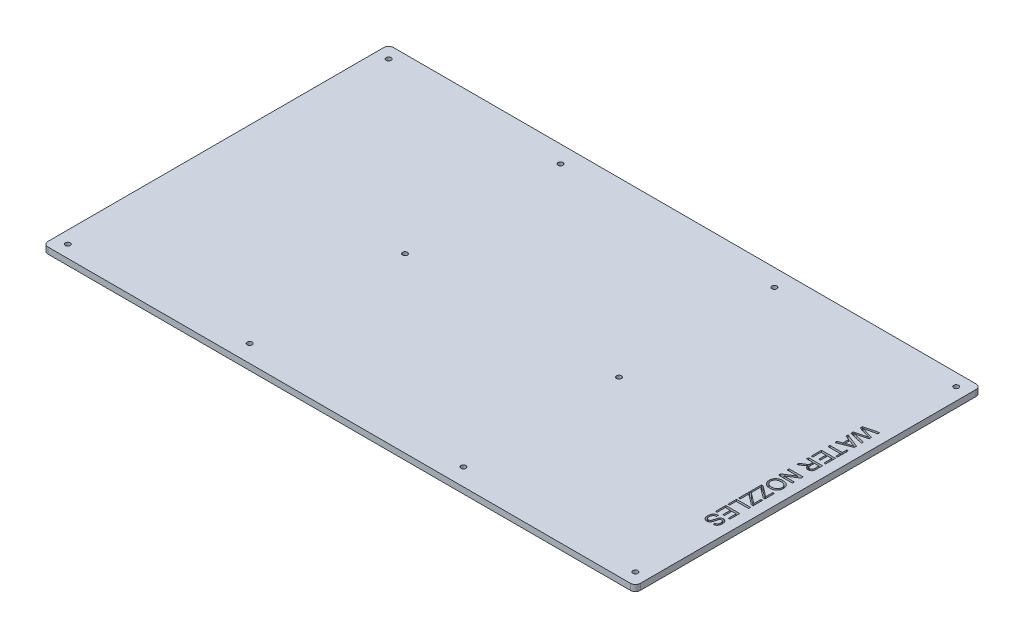
from build123d import *

# Parameters (mm, degrees)
SKETCH1_W           = 304.8
SKETCH1_H           = 177.8
SKETCH1_R           = 1.27
BOSS_EXTRUDE1_DEPTH = 3.175
CUT_EXTRUDE1_DEPTH  = 2.54
FILLET1_R           = 2.54


with BuildPart() as part:
    # Sketch1 → Boss-Extrude1 (new body)
    with BuildSketch(Plane(origin=(0, 0, 0), x_dir=(1, 0, 0), z_dir=(0, 1, 0))):
        Rectangle(SKETCH1_W, SKETCH1_H)
        with Locations(Location((-55.0291, 80.01, 0), (0, 0, 270))):
            Circle(SKETCH1_R, mode=Mode.SUBTRACT)
        with Locations(Location((-55.033333333, 0, 0), (0, 0, 270))):
            Circle(SKETCH1_R, mode=Mode.SUBTRACT)
        with Locations(Location((-55.0291, -80.01, 0), (0, 0, 270))):
            Circle(SKETCH1_R, mode=Mode.SUBTRACT)
        with Locations(Location((55.0291, -80.01, 0), (0, 0, 270))):
            Circle(SKETCH1_R, mode=Mode.SUBTRACT)
        with Locations(Location((55.033333333, 0, 0), (0, 0, 270))):
            Circle(SKETCH1_R, mode=Mode.SUBTRACT)
        with Locations(Location((55.0291, 80.01, 0), (0, 0, 270))):
            Circle(SKETCH1_R, mode=Mode.SUBTRACT)
        with Locations(Location((-146.05, 82.55, 0), (0, 0, 270))):
            Circle(SKETCH1_R, mode=Mode.SUBTRACT)
        with Locations(Location((-146.05, -82.55, 0), (0, 0, 270))):
            Circle(SKETCH1_R, mode=Mode.SUBTRACT)
        with Locations(Location((146.05, -82.55, 0), (0, 0, 270))):
            Circle(SKETCH1_R, mode=Mode.SUBTRACT)
        with Locations(Location((146.05, 82.55, 0), (0, 0, 270))):
            Circle(SKETCH1_R, mode=Mode.SUBTRACT)
    extrude(amount=BOSS_EXTRUDE1_DEPTH)

    # Sketch2 → Cut-Extrude1 (cut)
    # profile 1 of 12: a face of its own
    with BuildSketch(Plane(origin=(0, 3.175, 0), x_dir=(1, 0, 0), z_dir=(0, 1, 0))):
        with BuildLine():
            Line((139.7, 40.599397314), (146.891292318, 42.410185463))
            Line((146.891292318, 42.410185463), (146.891292318, 41.362895897))
            Line((146.891292318, 41.362895897), (142.161922791, 40.295438444))
            add(Edge.make_bspline(
                [(142.161922791, 40.295438444), (141.918010101, 40.240116159), (141.43267487, 40.130036385), (140.947069932, 40.021152573), (140.705513229, 39.966989996)],
                knots=[0, 0, 0, 0, 1.00513078, 2, 2, 2, 2], degree=3))
            add(Edge.make_bspline(
                [(140.705513229, 39.966989996), (140.792371041, 39.941345716), (140.956342762, 39.892933987), (141.188788479, 39.827490711), (141.391660637, 39.768050681), (141.565904996, 39.717410826), (141.711766359, 39.676407931), (141.82745239, 39.641006497), (141.915228597, 39.616877322), (141.963619911, 39.602578329), (141.983292933, 39.596765212)],
                knots=[0, 0, 0, 0, 1.633809233, 3.084334118, 4.356383392, 5.447555203, 6.357852567, 7.089694452, 7.629924063, 8, 8, 8, 8], degree=3))
            Line((141.983292933, 39.596765212), (146.891292318, 38.176369734))
            Line((146.891292318, 38.176369734), (146.891292318, 36.956212564))
            Line((146.891292318, 36.956212564), (143.288443342, 35.929090885))
            add(Edge.make_bspline(
                [(143.288443342, 35.929090885), (143.065873463, 35.872408071), (142.627013829, 35.760641828), (141.973316149, 35.612142336), (141.335477306, 35.475082051), (140.913616359, 35.396132754), (140.705513229, 35.357187229)],
                knots=[0, 0, 0, 0, 1.04154457, 2.053700482, 3.039894486, 4, 4, 4, 4], degree=3))
            add(Edge.make_bspline(
                [(140.705513229, 35.357187229), (140.812108286, 35.333148364), (141.036323517, 35.282584298), (141.390339814, 35.203396852), (141.778206423, 35.11544733), (142.048588999, 35.054626897), (142.189293495, 35.022976528)],
                knots=[0, 0, 0, 0, 0.862132589, 1.813435466, 2.862132822, 4, 4, 4, 4], degree=3))
            Line((142.189293495, 35.022976528), (146.891292318, 33.961281328))
            Line((146.891292318, 33.961281328), (146.891292318, 32.913991762))
            Line((146.891292318, 32.913991762), (139.7, 34.726220475))
            Line((139.7, 34.726220475), (139.7, 35.841216519))
            Line((139.7, 35.841216519), (145.195749237, 37.343724109))
            add(Edge.make_bspline(
                [(145.195749237, 37.343724109), (145.249475294, 37.35881145), (145.351534795, 37.387471778), (145.497177163, 37.425038757), (145.625263633, 37.462292796), (145.737449513, 37.491924711), (145.832604318, 37.517568652), (145.910449451, 37.540277459), (145.972508465, 37.554883152), (146.007780963, 37.565445312), (146.022632609, 37.569892557)],
                knots=[0, 0, 0, 0, 1.562239628, 2.967673567, 4.210417925, 5.296319877, 6.215971374, 6.969386481, 7.566055473, 8, 8, 8, 8], degree=3))
            add(Edge.make_bspline(
                [(146.022632609, 37.569892557), (145.928450634, 37.596558009), (145.750492988, 37.646942608), (145.499965869, 37.721559871), (145.2796766, 37.784171595), (145.143390879, 37.823850077), (145.080504168, 37.842159033)],
                knots=[0, 0, 0, 0, 1.197730334, 2.263121701, 3.198547257, 4, 4, 4, 4], degree=3))
            Line((145.080504168, 37.842159033), (139.7, 39.399408031))
            Line((139.7, 39.399408031), (139.7, 40.599397314))
        make_face()
    # profile 2 of 12: a face of its own
    with BuildSketch(Plane(origin=(0, 3.175, 0), x_dir=(1, 0, 0), z_dir=(0, 1, 0))):
        Polygon((139.7, 33.252524153), (146.891292318, 30.397327563), (146.891292318, 29.253520252), (139.7, 26.398323662), (139.7, 27.474424496), (141.912705329, 28.292664487), (141.912705329, 31.358183328), (139.7, 32.176423319), align=None)
        with BuildLine():
            Line((142.742469827, 31.052783894), (142.742469827, 28.598063921))
            Line((142.742469827, 28.598063921), (144.632488962, 29.296737152))
            add(Edge.make_bspline(
                [(144.632488962, 29.296737152), (144.705516725, 29.32352179), (144.848299792, 29.375890813), (145.055751534, 29.453988804), (145.252756224, 29.52533787), (145.436489095, 29.595301488), (145.609619053, 29.658458896), (145.770976683, 29.716672698), (145.919440472, 29.774245656), (146.015363377, 29.808795999), (146.06152782, 29.825423907)],
                knots=[0, 0, 0, 0, 1.225184869, 2.395467751, 3.491410812, 4.525364584, 5.492066482, 6.394148129, 7.227157926, 8, 8, 8, 8], degree=3))
            add(Edge.make_bspline(
                [(146.06152782, 29.825423907), (145.947690369, 29.852929678), (145.71954608, 29.908054634), (145.385284092, 30.02347287), (145.05407908, 30.155507323), (144.840652831, 30.262735032), (144.733328397, 30.316656015)],
                knots=[0, 0, 0, 0, 0.9891762, 1.982431084, 2.985436691, 4, 4, 4, 4], degree=3))
            Line((144.733328397, 30.316656015), (142.742469827, 31.052783894))
        make_face(mode=Mode.SUBTRACT)
    # profile 3 of 12: a face of its own
    with BuildSketch(Plane(origin=(0, 3.175, 0), x_dir=(1, 0, 0), z_dir=(0, 1, 0))):
        Polygon((139.7, 23.878778337), (146.06152782, 23.878778337), (146.06152782, 26.183679721), (146.891292318, 26.183679721), (146.891292318, 20.559720344), (146.06152782, 20.559720344), (146.06152782, 22.864621728), (139.7, 22.864621728), align=None)
    # profile 4 of 12: a face of its own
    with BuildSketch(Plane(origin=(0, 3.175, 0), x_dir=(1, 0, 0), z_dir=(0, 1, 0))):
        Polygon((139.7, 19.545563735), (146.891292318, 19.545563735), (146.891292318, 14.474780691), (146.06152782, 14.474780691), (146.06152782, 18.531407126), (143.848822491, 18.531407126), (143.848822491, 14.751368857), (143.019057993, 14.751368857), (143.019057993, 18.531407126), (140.529764498, 18.531407126), (140.529764498, 14.29038858), (139.7, 14.29038858), align=None)
    # profile 5 of 12: a face of its own
    with BuildSketch(Plane(origin=(0, 3.175, 0), x_dir=(1, 0, 0), z_dir=(0, 1, 0))):
        with BuildLine():
            Line((139.7, 12.90744775), (146.891292318, 12.90744775))
            Line((146.891292318, 12.90744775), (146.891292318, 9.787187501))
            add(Edge.make_bspline(
                [(146.891292318, 9.787187501), (146.890719358, 9.713714577), (146.88961046, 9.571516331), (146.881686545, 9.365305218), (146.864852182, 9.173282605), (146.846050259, 8.99423828), (146.818288848, 8.828478621), (146.785719716, 8.675924614), (146.747226755, 8.537161395), (146.70172659, 8.41113294), (146.65026646, 8.294196999), (146.586739284, 8.185835298), (146.517241888, 8.081403532), (146.434932223, 7.98503292), (146.346427046, 7.89250504), (146.247351056, 7.806981757), (146.139103449, 7.728045686), (145.984348252, 7.630645623), (145.777192572, 7.528158567), (145.513452672, 7.440686114), (145.236989629, 7.384760592), (145.048120631, 7.378739403), (144.952294029, 7.375684428)],
                knots=[0, 0, 0, 0, 1.242122331, 2.403982386, 3.487329914, 4.500326623, 5.446523787, 6.327028739, 7.136568587, 7.878666205, 8.590811102, 9.292609518, 9.999600102, 10.708452415, 11.431798422, 12.162621657, 12.917616336, 13.694634159, 15.252079616, 16.810286496, 18.381632726, 20, 20, 20, 20], degree=3))
            add(Edge.make_bspline(
                [(144.952294029, 7.375684428), (144.890778569, 7.37709165), (144.769281319, 7.379871008), (144.590647648, 7.401160869), (144.419971093, 7.439683966), (144.255753461, 7.48907958), (144.100333994, 7.556697048), (143.950491545, 7.63499364), (143.810516278, 7.732126935), (143.675747631, 7.84058847), (143.552200949, 7.966682451), (143.438215685, 8.107045246), (143.339735409, 8.265209511), (143.25123324, 8.438264749), (143.173787754, 8.626524977), (143.10867237, 8.83124209), (143.057693754, 9.051691208), (143.032157635, 9.204567236), (143.019057993, 9.282990324)],
                knots=[0, 0, 0, 0, 0.98268397, 1.940868231, 2.867803148, 3.77529712, 4.675825539, 5.571570676, 6.471608834, 7.392971743, 8.331421822, 9.286283743, 10.275919943, 11.301762849, 12.388744527, 13.524158817, 14.729930953, 16, 16, 16, 16], degree=3))
            add(Edge.make_bspline(
                [(143.019057993, 9.282990324), (142.989925812, 9.2250232), (142.934789019, 9.115312181), (142.846271077, 8.963984742), (142.758672467, 8.834036947), (142.694617331, 8.759083356), (142.664679405, 8.724051738)],
                knots=[0, 0, 0, 0, 1.172410807, 2.218954047, 3.167579294, 4, 4, 4, 4], degree=3))
            add(Edge.make_bspline(
                [(142.664679405, 8.724051738), (142.598176784, 8.65600296), (142.46179086, 8.516446123), (142.2273313, 8.326002591), (141.969492889, 8.137560987), (141.78160129, 8.024424583), (141.685096317, 7.966315408)],
                knots=[0, 0, 0, 0, 0.918170575, 1.883016652, 2.912673989, 4, 4, 4, 4], degree=3))
            Line((141.685096317, 7.966315408), (139.7, 6.786494012))
            Line((139.7, 6.786494012), (139.7, 7.949028648))
            Line((139.7, 7.949028648), (141.218353787, 8.845059061))
            add(Edge.make_bspline(
                [(141.218353787, 8.845059061), (141.271626158, 8.877277139), (141.374859267, 8.939710486), (141.525640959, 9.0298715), (141.664406238, 9.11835134), (141.795360764, 9.200146835), (141.915099613, 9.2796333), (142.027194869, 9.352347094), (142.127215347, 9.423882684), (142.247678565, 9.507079512), (142.378793463, 9.607385335), (142.51264314, 9.725227599), (142.621935013, 9.834572419), (142.727516561, 9.971377692), (142.8258971, 10.141134426), (142.871617982, 10.285131355), (142.89372898, 10.354769467)],
                knots=[0, 0, 0, 0, 1.130769053, 2.191244754, 3.190605808, 4.119719489, 4.995392299, 5.800890497, 6.546104885, 7.228445539, 8.4599972, 9.541354885, 10.466489475, 11.262010607, 12.675885558, 14, 14, 14, 14], degree=3))
            add(Edge.make_bspline(
                [(142.89372898, 10.354769467), (142.899000238, 10.383999999), (142.911034679, 10.450734181), (142.918894392, 10.564048654), (142.927236425, 10.701343041), (142.926993366, 10.800842622), (142.926861937, 10.854644955)],
                knots=[0, 0, 0, 0, 0.709978628, 1.620902492, 2.713552433, 4, 4, 4, 4], degree=3))
            Line((142.926861937, 10.854644955), (142.926861937, 11.893291141))
            Line((142.926861937, 11.893291141), (139.7, 11.893291141))
            Line((139.7, 11.893291141), (139.7, 12.90744775))
        make_face()
        with BuildLine():
            Line((143.756626436, 11.893291141), (143.756626436, 9.967257922))
            add(Edge.make_bspline(
                [(143.756626436, 9.967257922), (143.758143556, 9.870680588), (143.76097967, 9.690138321), (143.785027209, 9.437659887), (143.823660549, 9.222100977), (143.879107351, 9.039438161), (143.956434937, 8.886057448), (144.052511636, 8.754288984), (144.169411157, 8.642191056), (144.303830251, 8.550576168), (144.450495496, 8.478417995), (144.605647263, 8.429158458), (144.765929244, 8.394839629), (144.875280389, 8.391521992), (144.930685578, 8.389841037)],
                knots=[0, 0, 0, 0, 1.545806995, 2.889741191, 4.055176196, 5.047087691, 5.934047151, 6.79198357, 7.645535072, 8.5133672, 9.386595861, 10.252007348, 11.114340652, 12, 12, 12, 12], degree=3))
            add(Edge.make_bspline(
                [(144.930685578, 8.389841037), (144.971051349, 8.391179534), (145.050116036, 8.393801256), (145.166161046, 8.407545188), (145.276430627, 8.434266655), (145.381507679, 8.469552288), (145.480622586, 8.516701053), (145.574543379, 8.572711862), (145.662749512, 8.639550049), (145.745509673, 8.716109346), (145.820813333, 8.804013332), (145.885784057, 8.90442035), (145.940995157, 9.016538495), (145.984814377, 9.140498087), (146.01986262, 9.27590863), (146.043179085, 9.423540987), (146.060050802, 9.582720003), (146.061026282, 9.69302183), (146.06152782, 9.749732854)],
                knots=[0, 0, 0, 0, 0.965208469, 1.890559848, 2.786986821, 3.67262109, 4.535197034, 5.405224191, 6.282113641, 7.175449223, 8.095446547, 9.040936516, 10.026471658, 11.075712529, 12.17809725, 13.364958037, 14.645208957, 16, 16, 16, 16], degree=3))
            Line((146.06152782, 9.749732854), (146.06152782, 11.893291141))
            Line((146.06152782, 11.893291141), (143.756626436, 11.893291141))
        make_face(mode=Mode.SUBTRACT)
    # profile 6 of 12: a face of its own
    with BuildSketch(Plane(origin=(0, 3.175, 0), x_dir=(1, 0, 0), z_dir=(0, 1, 0))):
        Polygon((139.7, 2.950273771), (146.891292318, 2.950273771), (146.891292318, 1.878494628), (141.525193783, -1.567332941), (146.891292318, -1.567332941), (146.891292318, -2.58148955), (139.7, -2.58148955), (139.7, -1.509710406), (145.066098534, 1.936117162), (139.7, 1.936117162), align=None)
    # profile 7 of 12: a face of its own
    with BuildSketch(Plane(origin=(0, 3.175, 0), x_dir=(1, 0, 0), z_dir=(0, 1, 0))):
        with BuildLine():
            add(Edge.make_bspline(
                [(143.200568977, -3.872234325), (143.344742891, -3.874750601), (143.625658451, -3.879653438), (144.034795943, -3.92492341), (144.419281361, -3.999605887), (144.780893264, -4.102339363), (145.116904413, -4.238978276), (145.431446648, -4.401107285), (145.719045321, -4.597822571), (145.983025744, -4.820098076), (146.216382386, -5.068437708), (146.42364216, -5.332831608), (146.59651991, -5.61660193), (146.739260307, -5.917121453), (146.848852157, -6.235668389), (146.925576448, -6.57134797), (146.975071065, -6.923801293), (146.98064185, -7.164711385), (146.983488373, -7.287810063)],
                knots=[0, 0, 0, 0, 1.203593535, 2.345140965, 3.431924157, 4.471254512, 5.478692091, 6.45615896, 7.42038538, 8.382007041, 9.33218277, 10.260966195, 11.182476517, 12.100814648, 13.034113903, 13.98924309, 14.972556454, 16, 16, 16, 16], degree=3))
            add(Edge.make_bspline(
                [(146.983488373, -7.287810063), (146.982083246, -7.369004565), (146.979292919, -7.530242159), (146.957643942, -7.769046914), (146.920039242, -8.001421819), (146.86778006, -8.227532904), (146.801835233, -8.447603788), (146.721044891, -8.662083881), (146.623835099, -8.869598947), (146.513808435, -9.070695723), (146.389328101, -9.262238692), (146.254649039, -9.444049022), (146.106799681, -9.613148244), (145.947920566, -9.77054561), (145.777938945, -9.9165831), (145.594741796, -10.049441633), (145.401125111, -10.171807619), (145.195584993, -10.28104651), (144.982240572, -10.3788984), (144.760014789, -10.462484041), (144.531625728, -10.534270472), (144.295707331, -10.594358298), (144.052344136, -10.637473782), (143.802583707, -10.671806857), (143.545610036, -10.689877354), (143.372019731, -10.693107052), (143.284121652, -10.694742421)],
                knots=[0, 0, 0, 0, 1.034309052, 2.053950705, 3.051627699, 4.031038476, 5.008402854, 5.97643726, 6.948041091, 7.925482047, 8.894385902, 9.856059247, 10.805611944, 11.752954998, 12.703138077, 13.657545741, 14.63347317, 15.618750787, 16.620694897, 17.621667406, 18.641309059, 19.669521506, 20.720627516, 21.788266251, 22.880080611, 24, 24, 24, 24], degree=3))
            add(Edge.make_bspline(
                [(143.284121652, -10.694742421), (143.194774132, -10.693244066), (143.018252702, -10.690283806), (142.75747654, -10.670253479), (142.504186722, -10.635033201), (142.257627978, -10.588319503), (142.018313612, -10.525724559), (141.78555742, -10.451340137), (141.560746026, -10.361367792), (141.343336543, -10.259754686), (141.136322927, -10.144777048), (140.941138804, -10.017957762), (140.759660471, -9.879166874), (140.589476659, -9.7306586), (140.434565882, -9.56868993), (140.290383421, -9.3967376), (140.161526545, -9.211921943), (140.044348478, -9.017795627), (139.943626094, -8.815008266), (139.85320227, -8.608118694), (139.77713015, -8.396879802), (139.714892871, -8.181819365), (139.667370015, -7.96275636), (139.63270603, -7.740089103), (139.612261458, -7.512920576), (139.609297418, -7.360358764), (139.607803945, -7.283488373)],
                knots=[0, 0, 0, 0, 1.141388526, 2.255009839, 3.338557341, 4.406873761, 5.458773361, 6.496627797, 7.526383469, 8.5499449, 9.560445588, 10.548978906, 11.520676971, 12.476877461, 13.431305422, 14.380871584, 15.340724931, 16.306479833, 17.274880643, 18.230982746, 19.189541512, 20.140849708, 21.088988189, 22.051132196, 23.018035844, 24, 24, 24, 24], degree=3))
            add(Edge.make_bspline(
                [(139.607803945, -7.283488373), (139.609026868, -7.200837462), (139.611449174, -7.037126706), (139.635624736, -6.795157068), (139.672512416, -6.559210096), (139.725741713, -6.329958393), (139.795273652, -6.107764179), (139.878947671, -5.892589322), (139.977210681, -5.683912211), (140.091114191, -5.483159574), (140.216853762, -5.290518027), (140.356042488, -5.109892863), (140.505615144, -4.940767394), (140.667824314, -4.78521722), (140.839585734, -4.640794425), (141.022012391, -4.507224855), (141.216181233, -4.386540322), (141.421009429, -4.27937035), (141.631310907, -4.18273359), (141.84697264, -4.101270405), (142.064864534, -4.029692273), (142.286316752, -3.972684518), (142.51082187, -3.927257082), (142.738005404, -3.896710233), (142.968205951, -3.87464912), (143.122724858, -3.873043307), (143.200568977, -3.872234325)],
                knots=[0, 0, 0, 0, 1.072763531, 2.124875893, 3.153923666, 4.171672792, 5.177320289, 6.174136357, 7.166947757, 8.169130198, 9.168574722, 10.151174515, 11.127106349, 12.097106019, 13.066163601, 14.038804255, 15.030068075, 16.031241659, 17.038395341, 18.032966873, 19.022680693, 20.014630449, 21.000093848, 21.9946263, 22.989725266, 24, 24, 24, 24], degree=3))
        make_face()
        with BuildLine():
            add(Edge.make_bspline(
                [(143.18904447, -4.886390934), (143.085221971, -4.8879442), (142.882775424, -4.890972961), (142.587626766, -4.925655463), (142.309110467, -4.978218734), (142.04657521, -5.050883677), (141.801950955, -5.147900238), (141.574767951, -5.266514417), (141.363952405, -5.405651782), (141.171893417, -5.565239122), (140.999302669, -5.740590433), (140.848487893, -5.927974178), (140.722728679, -6.127216277), (140.6176871, -6.335678791), (140.536752949, -6.556125666), (140.479539754, -6.78750075), (140.443827808, -7.029799504), (140.439680892, -7.195008701), (140.437568443, -7.279166683)],
                knots=[0, 0, 0, 0, 1.215616022, 2.370365452, 3.475740397, 4.533490648, 5.5560781, 6.552384115, 7.530550651, 8.509299237, 9.471863928, 10.40830403, 11.321168121, 12.226759389, 13.137923578, 14.065605683, 15.014614662, 16, 16, 16, 16], degree=3))
            add(Edge.make_bspline(
                [(140.437568443, -7.279166683), (140.439710612, -7.364751904), (140.443904973, -7.532327525), (140.479014467, -7.778268523), (140.538786878, -8.011940024), (140.618357524, -8.235658031), (140.725923367, -8.445378297), (140.851882769, -8.646004235), (141.005800048, -8.832071834), (141.178701115, -9.008128732), (141.375212877, -9.166098945), (141.590597748, -9.306038803), (141.827532292, -9.420500369), (142.082609039, -9.515981831), (142.357428744, -9.590879144), (142.651988993, -9.643239378), (142.965513323, -9.675529508), (143.180800424, -9.678870576), (143.291324469, -9.680585812)],
                knots=[0, 0, 0, 0, 0.976909331, 1.912785716, 2.828990727, 3.727421029, 4.617481149, 5.514840137, 6.426786422, 7.368873452, 8.327895072, 9.299698503, 10.295216142, 11.325792517, 12.405818789, 13.542541501, 14.738390493, 16, 16, 16, 16], degree=3))
            add(Edge.make_bspline(
                [(143.291324469, -9.680585812), (143.362425152, -9.679973492), (143.501898963, -9.678772341), (143.70748495, -9.662865064), (143.906676055, -9.642346743), (144.099215164, -9.611107188), (144.284305234, -9.568055435), (144.46335426, -9.520360321), (144.634823252, -9.460723284), (144.799370302, -9.39304249), (144.956202525, -9.317360319), (145.103810699, -9.231814906), (145.242544392, -9.138069923), (145.372016781, -9.035938503), (145.492498367, -8.925780008), (145.603699761, -8.807282133), (145.706272053, -8.680155085), (145.799327504, -8.545135144), (145.883147711, -8.404352342), (145.954806581, -8.258012949), (146.018195963, -8.108144741), (146.065615012, -7.952681798), (146.10534388, -7.794141201), (146.134617552, -7.631591409), (146.149998026, -7.463860061), (146.152473006, -7.350742518), (146.153723875, -7.293572317)],
                knots=[0, 0, 0, 0, 1.220471707, 2.394123819, 3.538599016, 4.658184489, 5.740257119, 6.800339203, 7.838063059, 8.854709651, 9.853990799, 10.825506309, 11.781362566, 12.726491381, 13.654344845, 14.581758638, 15.513997413, 16.45624495, 17.395131889, 18.32430312, 19.252156584, 20.185670527, 21.111507116, 22.057642305, 23.018322208, 24, 24, 24, 24], degree=3))
            add(Edge.make_bspline(
                [(146.153723875, -7.293572317), (146.152077995, -7.21277849), (146.148820798, -7.052887511), (146.114128055, -6.81808813), (146.060877956, -6.5919658), (145.987756036, -6.374110973), (145.889798934, -6.165720828), (145.771818286, -5.965413326), (145.632145804, -5.774112058), (145.47246777, -5.591935999), (145.288171775, -5.422171447), (145.07105564, -5.278564966), (144.826119231, -5.157554337), (144.55403582, -5.056505561), (144.252683068, -4.979460811), (143.923362322, -4.926212708), (143.565725227, -4.892593093), (143.317814674, -4.888511173), (143.18904447, -4.886390934)],
                knots=[0, 0, 0, 0, 0.895069985, 1.771343461, 2.624796936, 3.468163849, 4.31361133, 5.172690577, 6.041527277, 6.935393444, 7.854933085, 8.810158187, 9.810009302, 10.877887247, 12.021813459, 13.252239476, 14.572752642, 16, 16, 16, 16], degree=3))
        make_face(mode=Mode.SUBTRACT)
    # profile 8 of 12: a face of its own
    with BuildSketch(Plane(origin=(0, 3.175, 0), x_dir=(1, 0, 0), z_dir=(0, 1, 0))):
        with BuildLine():
            Line((139.7, -11.340114809), (140.564338019, -11.340114809))
            Line((140.564338019, -11.340114809), (145.236085011, -14.88101956))
            add(Edge.make_bspline(
                [(145.236085011, -14.88101956), (145.314721794, -14.94119326), (145.465510402, -15.056578301), (145.683391248, -15.219549317), (145.87842203, -15.370205961), (146.002848792, -15.46361391), (146.06152782, -15.507664623)],
                knots=[0, 0, 0, 0, 1.146521337, 2.198492228, 3.150418105, 4, 4, 4, 4], degree=3))
            Line((146.06152782, -15.507664623), (146.06152782, -11.801095085))
            Line((146.06152782, -11.801095085), (146.891292318, -11.801095085))
            Line((146.891292318, -11.801095085), (146.891292318, -16.779682075))
            Line((146.891292318, -16.779682075), (146.06152782, -16.779682075))
            Line((146.06152782, -16.779682075), (140.992185338, -12.93769958))
            Line((140.992185338, -12.93769958), (140.529764498, -12.587642683))
            Line((140.529764498, -12.587642683), (140.529764498, -16.964074185))
            Line((140.529764498, -16.964074185), (139.7, -16.964074185))
            Line((139.7, -16.964074185), (139.7, -11.340114809))
        make_face()
    # profile 9 of 12: a face of its own
    with BuildSketch(Plane(origin=(0, 3.175, 0), x_dir=(1, 0, 0), z_dir=(0, 1, 0))):
        with BuildLine():
            Line((139.7, -17.425054462), (140.564338019, -17.425054462))
            Line((140.564338019, -17.425054462), (145.236085011, -20.965959213))
            add(Edge.make_bspline(
                [(145.236085011, -20.965959213), (145.314721794, -21.026132913), (145.465510402, -21.141517954), (145.683391248, -21.304488971), (145.87842203, -21.455145614), (146.002848792, -21.548553563), (146.06152782, -21.592604277)],
                knots=[0, 0, 0, 0, 1.146521337, 2.198492228, 3.150418105, 4, 4, 4, 4], degree=3))
            Line((146.06152782, -21.592604277), (146.06152782, -17.886034739))
            Line((146.06152782, -17.886034739), (146.891292318, -17.886034739))
            Line((146.891292318, -17.886034739), (146.891292318, -22.864621728))
            Line((146.891292318, -22.864621728), (146.06152782, -22.864621728))
            Line((146.06152782, -22.864621728), (140.992185338, -19.022639234))
            Line((140.992185338, -19.022639234), (140.529764498, -18.672582336))
            Line((140.529764498, -18.672582336), (140.529764498, -23.049013839))
            Line((140.529764498, -23.049013839), (139.7, -23.049013839))
            Line((139.7, -23.049013839), (139.7, -17.425054462))
        make_face()
    # profile 10 of 12: a face of its own
    with BuildSketch(Plane(origin=(0, 3.175, 0), x_dir=(1, 0, 0), z_dir=(0, 1, 0))):
        Polygon((139.7, -24.155366503), (146.891292318, -24.155366503), (146.891292318, -25.169523112), (140.529764498, -25.169523112), (140.529764498, -28.58077716), (139.7, -28.58077716), align=None)
    # profile 11 of 12: a face of its own
    with BuildSketch(Plane(origin=(0, 3.175, 0), x_dir=(1, 0, 0), z_dir=(0, 1, 0))):
        Polygon((139.7, -29.687129824), (146.891292318, -29.687129824), (146.891292318, -34.757912869), (146.06152782, -34.757912869), (146.06152782, -30.701286433), (143.848822491, -30.701286433), (143.848822491, -34.481324703), (143.019057993, -34.481324703), (143.019057993, -30.701286433), (140.529764498, -30.701286433), (140.529764498, -34.94230498), (139.7, -34.94230498), align=None)
    # profile 12 of 12: a face of its own
    with BuildSketch(Plane(origin=(0, 3.175, 0), x_dir=(1, 0, 0), z_dir=(0, 1, 0))):
        with BuildLine():
            Line((142.189293495, -35.956461589), (142.189293495, -36.970618197))
            add(Edge.make_bspline(
                [(142.189293495, -36.970618197), (142.098227577, -36.981757345), (141.923285047, -37.003156248), (141.675467459, -37.063286959), (141.451963587, -37.139758907), (141.252486254, -37.238292352), (141.074677214, -37.362432817), (140.916258038, -37.515197516), (140.777816883, -37.700138648), (140.656535096, -37.909646089), (140.559052, -38.141549993), (140.488167215, -38.389514826), (140.445784262, -38.652224335), (140.440345542, -38.832149429), (140.437568443, -38.92402212)],
                knots=[0, 0, 0, 0, 1.125661535, 2.162456423, 3.124646671, 4.021152204, 4.884793578, 5.777140414, 6.711097021, 7.712275503, 8.742730725, 9.791526725, 10.872317486, 12, 12, 12, 12], degree=3))
            add(Edge.make_bspline(
                [(140.437568443, -38.92402212), (140.439031704, -39.005324382), (140.44187622, -39.163372363), (140.477596268, -39.392598366), (140.527064736, -39.608441268), (140.602381616, -39.806959012), (140.695683221, -39.985963316), (140.80465797, -40.143354697), (140.932051158, -40.275186614), (141.073239919, -40.381340298), (141.223020959, -40.463802138), (141.377580062, -40.521272708), (141.533862437, -40.559970312), (141.639737395, -40.564176293), (141.692299134, -40.566264356)],
                knots=[0, 0, 0, 0, 1.267278989, 2.463534024, 3.612003651, 4.716903637, 5.765847919, 6.755281273, 7.693132489, 8.613187884, 9.50174055, 10.350585091, 11.181146174, 12, 12, 12, 12], degree=3))
            add(Edge.make_bspline(
                [(141.692299134, -40.566264356), (141.744337033, -40.564042154), (141.846149516, -40.559694401), (141.993229654, -40.525872371), (142.129589529, -40.469897461), (142.257456647, -40.392906632), (142.375516476, -40.287016906), (142.482170153, -40.151797624), (142.581694742, -39.987880384), (142.634997726, -39.864993089), (142.663238842, -39.799884646)],
                knots=[0, 0, 0, 0, 0.942390321, 1.843792698, 2.718029279, 3.604523015, 4.535311134, 5.574971969, 6.71516581, 8, 8, 8, 8], degree=3))
            add(Edge.make_bspline(
                [(142.663238842, -39.799884646), (142.673635955, -39.774549477), (142.697124923, -39.717312728), (142.728211504, -39.61920907), (142.768457767, -39.502809969), (142.809553502, -39.365687357), (142.854188881, -39.208036582), (142.902652909, -39.030219196), (142.956268911, -38.83246571), (143.012013971, -38.620457867), (143.069092289, -38.406013153), (143.126527692, -38.200751645), (143.183956445, -38.011604901), (143.240087198, -37.837555112), (143.296108725, -37.679613943), (143.350872692, -37.536970588), (143.403210454, -37.409429631), (143.441695304, -37.331532911), (143.459870382, -37.294744955)],
                knots=[0, 0, 0, 0, 0.499203687, 1.127791816, 1.87544445, 2.745218927, 3.737540508, 4.863437871, 6.106074846, 7.473929386, 8.860961239, 10.152791525, 11.360569269, 12.465464948, 13.48744072, 14.416013254, 15.251937243, 16, 16, 16, 16], degree=3))
            add(Edge.make_bspline(
                [(143.459870382, -37.294744955), (143.505623048, -37.210133689), (143.593937601, -37.046811926), (143.751163746, -36.826838811), (143.927308225, -36.643060923), (144.118845767, -36.492938182), (144.325275365, -36.37607482), (144.544730043, -36.294560307), (144.77540831, -36.24082041), (144.933741398, -36.235668829), (145.014238253, -36.233049755)],
                knots=[0, 0, 0, 0, 1.158753891, 2.236696577, 3.247844099, 4.216965963, 5.160353944, 6.094570301, 7.031275781, 8, 8, 8, 8], degree=3))
            add(Edge.make_bspline(
                [(145.014238253, -36.233049755), (145.103396921, -36.236463302), (145.280732865, -36.243252823), (145.540872551, -36.303775552), (145.791775547, -36.399659187), (145.989827633, -36.51112498), (146.140452636, -36.617968569), (146.24876493, -36.706588875), (146.348298702, -36.806008261), (146.442474176, -36.911877453), (146.52761287, -37.028786695), (146.606678461, -37.15309709), (146.67752327, -37.287393179), (146.76389859, -37.477525303), (146.852455254, -37.730417697), (146.929180236, -38.048830276), (146.974094122, -38.383972532), (146.980312663, -38.61272555), (146.983488373, -38.729546066)],
                knots=[0, 0, 0, 0, 1.2001067, 2.387003517, 3.579163215, 4.810460134, 5.437089112, 6.066784591, 6.693680817, 7.331043701, 7.974292474, 8.640345033, 9.314862782, 10.018578828, 11.453312207, 12.917685044, 14.425910937, 16, 16, 16, 16], degree=3))
            add(Edge.make_bspline(
                [(146.983488373, -38.729546066), (146.98060003, -38.857420886), (146.974986626, -39.105941625), (146.927025725, -39.46762655), (146.846144952, -39.805204568), (146.754621517, -40.070252392), (146.662266515, -40.265896705), (146.590187472, -40.404884772), (146.506855035, -40.533893545), (146.416676094, -40.654085404), (146.319689217, -40.766569316), (146.21360136, -40.868482392), (146.101979476, -40.964143518), (145.942128649, -41.07682639), (145.72893327, -41.195650126), (145.455713009, -41.303923255), (145.16477571, -41.372481181), (144.964647565, -41.388096175), (144.8629791, -41.396028855)],
                knots=[0, 0, 0, 0, 1.607767564, 3.124646298, 4.577694013, 5.968230118, 6.64098443, 7.297468537, 7.935727887, 8.569831019, 9.186231226, 9.801209789, 10.418260488, 11.033239051, 12.257996117, 13.47812891, 14.718847046, 16, 16, 16, 16], degree=3))
            Line((144.8629791, -41.396028855), (144.8629791, -40.381872246))
            add(Edge.make_bspline(
                [(144.8629791, -40.381872246), (144.914525152, -40.375640591), (145.015489235, -40.363434548), (145.160585877, -40.329181339), (145.296895335, -40.288245811), (145.422777496, -40.236062187), (145.539379887, -40.174418579), (145.644406276, -40.099743281), (145.741911683, -40.017896579), (145.829209147, -39.924784264), (145.905892271, -39.820234025), (145.972322456, -39.704170215), (146.028477465, -39.576629878), (146.074459997, -39.437659639), (146.110115899, -39.287250812), (146.136344264, -39.125055841), (146.149777166, -38.951139003), (146.152385133, -38.831365119), (146.153723875, -38.76988184)],
                knots=[0, 0, 0, 0, 1.074597235, 2.104830896, 3.08320792, 4.01963776, 4.922947153, 5.808618242, 6.683501764, 7.556007728, 8.44518997, 9.363001905, 10.32032511, 11.326760392, 12.390579697, 13.518793479, 14.726327422, 16, 16, 16, 16], degree=3))
            add(Edge.make_bspline(
                [(146.153723875, -38.76988184), (146.153242696, -38.705972623), (146.152311252, -38.582260096), (146.135305996, -38.403423248), (146.112008952, -38.237651492), (146.077524005, -38.085287793), (146.032908805, -37.947055563), (145.980175443, -37.821112723), (145.914664236, -37.710081222), (145.841349306, -37.611308695), (145.759438373, -37.526611248), (145.675510216, -37.451159024), (145.585990201, -37.388913723), (145.493846569, -37.335456359), (145.395126212, -37.29776974), (145.294119688, -37.268273821), (145.188699933, -37.250319392), (145.117067801, -37.248258379), (145.080504168, -37.247206364)],
                knots=[0, 0, 0, 0, 1.464643987, 2.835190547, 4.115048982, 5.300866033, 6.411522794, 7.442255218, 8.424145068, 9.359957701, 10.255529779, 11.121374133, 11.943044406, 12.751479056, 13.556984722, 14.358492815, 15.162115312, 16, 16, 16, 16], degree=3))
            add(Edge.make_bspline(
                [(145.080504168, -37.247206364), (145.01863345, -37.249827183), (144.898548091, -37.254913952), (144.727942994, -37.306857298), (144.572425394, -37.386746529), (144.487809062, -37.46545015), (144.445215724, -37.505067206)],
                knots=[0, 0, 0, 0, 1.050964922, 2.039826012, 3.013306874, 4, 4, 4, 4], degree=3))
            add(Edge.make_bspline(
                [(144.445215724, -37.505067206), (144.423929608, -37.530041374), (144.376856676, -37.585270206), (144.314561257, -37.688031986), (144.251619181, -37.815441223), (144.189052223, -37.968349964), (144.12608776, -38.14649181), (144.061306532, -38.349594379), (143.996627982, -38.57881285), (143.935337661, -38.8265667), (143.872301749, -39.07647453), (143.810549238, -39.313746016), (143.751698246, -39.531962053), (143.694350717, -39.73039605), (143.638603387, -39.90923685), (143.583303603, -40.067866774), (143.532441227, -40.207568312), (143.496655487, -40.29315203), (143.48003827, -40.332893091)],
                knots=[0, 0, 0, 0, 0.523891657, 1.158554055, 1.913784378, 2.794767528, 3.797522645, 4.933640231, 6.202082727, 7.603978424, 9.013314845, 10.322177672, 11.523239011, 12.626145434, 13.623952425, 14.517289202, 15.3114987, 16, 16, 16, 16], degree=3))
            add(Edge.make_bspline(
                [(143.48003827, -40.332893091), (143.456200665, -40.384599637), (143.409411443, -40.486090922), (143.329494727, -40.629843092), (143.246621594, -40.764069125), (143.157821733, -40.887574131), (143.064922594, -41.001079951), (142.966861321, -41.103895701), (142.863327992, -41.195385156), (142.721289412, -41.303908777), (142.529500697, -41.415181345), (142.281657836, -41.510802434), (142.016850315, -41.570611546), (141.834272362, -41.577110695), (141.741278288, -41.580420965)],
                knots=[0, 0, 0, 0, 0.899337291, 1.765248388, 2.59684015, 3.3906421, 4.166844185, 4.912752363, 5.632941945, 6.347675468, 7.734877245, 9.118505574, 10.532342477, 12, 12, 12, 12], degree=3))
            add(Edge.make_bspline(
                [(141.741278288, -41.580420965), (141.647294493, -41.576667966), (141.460705423, -41.569217015), (141.185664504, -41.505061641), (140.919151389, -41.40427694), (140.707658551, -41.286081915), (140.546108758, -41.174351891), (140.42999415, -41.0804934), (140.322628501, -40.97640973), (140.220648249, -40.864663316), (140.126134124, -40.744386551), (140.039053943, -40.614565427), (139.958501207, -40.476570146), (139.860342982, -40.279516355), (139.757660158, -40.017796183), (139.67214938, -39.684417226), (139.616676423, -39.333076184), (139.610802309, -39.091823738), (139.607803945, -38.968679585)],
                knots=[0, 0, 0, 0, 1.197055466, 2.376552968, 3.581957237, 4.820753935, 5.454298064, 6.085440993, 6.72202542, 7.359198513, 8.013298489, 8.67051481, 9.351020706, 10.049282741, 11.476266879, 12.925760103, 14.430794493, 16, 16, 16, 16], degree=3))
            add(Edge.make_bspline(
                [(139.607803945, -38.968679585), (139.608469982, -38.890383529), (139.609778732, -38.736533456), (139.624868277, -38.511145505), (139.647360417, -38.29520848), (139.680173845, -38.089285872), (139.723876534, -37.892797237), (139.775031989, -37.70596567), (139.835883639, -37.528807978), (139.905943012, -37.361413528), (139.987910607, -37.20389291), (140.076102737, -37.053550828), (140.176873201, -36.913171473), (140.285662361, -36.780849601), (140.404624909, -36.657512962), (140.53315623, -36.54391707), (140.670523665, -36.438070055), (140.817054123, -36.341999298), (140.971012045, -36.256207986), (141.129762457, -36.179048126), (141.294470338, -36.114042164), (141.464299684, -36.061652945), (141.638114956, -36.017276792), (141.81736608, -35.986502916), (142.001490342, -35.963876938), (142.12632268, -35.958947972), (142.189293495, -35.956461589)],
                knots=[0, 0, 0, 0, 1.259794174, 2.475468585, 3.633483936, 4.752716887, 5.828920721, 6.87130154, 7.868357378, 8.841438305, 9.788394823, 10.72402761, 11.64389108, 12.56602382, 13.478685853, 14.398289622, 15.324106125, 16.267144882, 17.215109807, 18.158654996, 19.105737623, 20.061356657, 21.017194371, 21.990367343, 22.986254633, 24, 24, 24, 24], degree=3))
        make_face()
    extrude(amount=-CUT_EXTRUDE1_DEPTH, mode=Mode.SUBTRACT)

    # Fillet1
    fillet1_edges = [part.edges().sort_by_distance(p)[0] for p in [
        (152.4, 1.5875, 88.9),
        (-152.4, 1.5875, 88.9),
        (-152.4, 1.5875, -88.9),
        (152.4, 1.5875, -88.9),
    ]]
    fillet(fillet1_edges, radius=FILLET1_R)


solid = part.part
